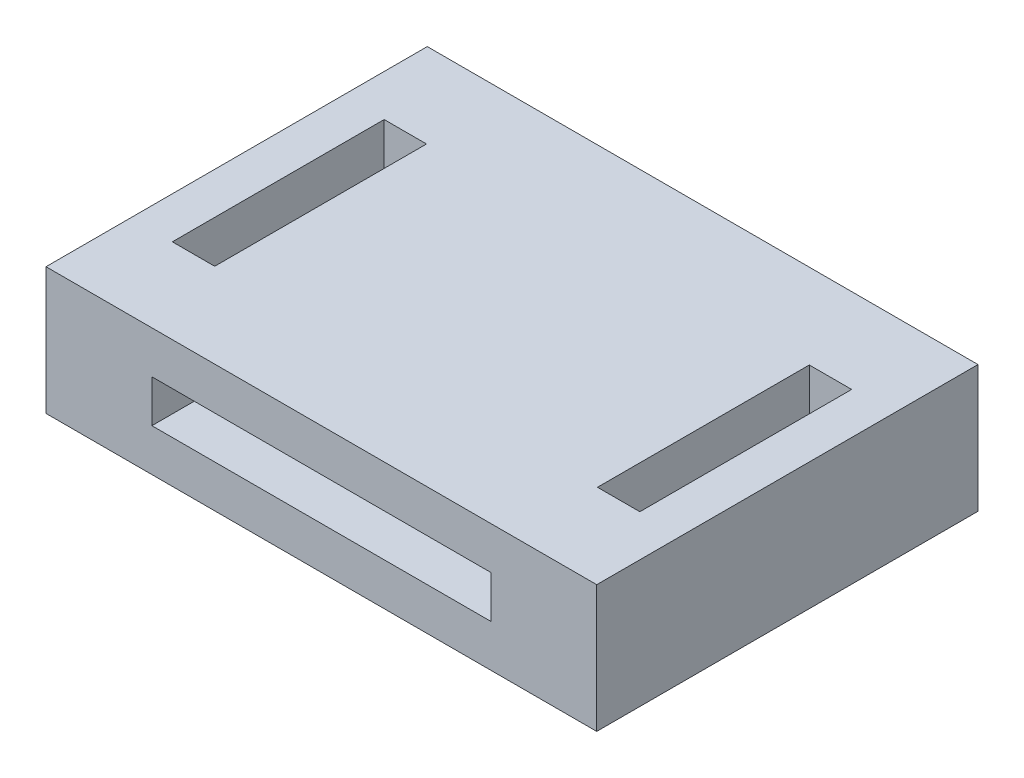
from build123d import *

# Parameters (mm, degrees)
SKETCH1_W           = 33.02
SKETCH1_H           = 22.86
SKETCH1_W_2         = 2.54
SKETCH1_H_2         = 12.7
BOSS_EXTRUDE2_DEPTH = 2.54
SKETCH3_R           = 1.016
BOSS_EXTRUDE3_DEPTH = 2.54
SKETCH4_W           = 33.02
SKETCH4_H           = 22.86
SKETCH4_W_2         = 2.54
SKETCH4_H_2         = 12.7
BOSS_EXTRUDE6_DEPTH = 2.54
SKETCH5_W           = 2.54
SKETCH5_H           = 12.7
BOSS_EXTRUDE7_DEPTH = 2.54


with BuildPart() as part:
    # Sketch1 → Boss-Extrude2 (new body)
    with BuildSketch(Plane(origin=(0, 0, 0), x_dir=(1, 0, 0), z_dir=(0, 1, 0))):
        Rectangle(SKETCH1_W, SKETCH1_H)
        with Locations((-12.74489899, 0)):
            Rectangle(SKETCH1_W_2, SKETCH1_H_2, mode=Mode.SUBTRACT)
        with Locations((12.74489899, 0)):
            Rectangle(SKETCH1_W_2, SKETCH1_H_2, mode=Mode.SUBTRACT)
    extrude(amount=BOSS_EXTRUDE2_DEPTH)

    # Sketch3 → Boss-Extrude3 (add)
    with BuildSketch(Plane(origin=(0, 2.54, 0), x_dir=(1, 0, 0), z_dir=(0, 1, 0))):
        with Locations(Location((-5.318941048, 1.27, 0), (0, 0, 90))):
            Circle(SKETCH3_R)
        with Locations(Location((5.318941048, 1.27, 0), (0, 0, 90))):
            Circle(SKETCH3_R)
    extrude(amount=BOSS_EXTRUDE3_DEPTH)

    # Sketch4 → Boss-Extrude6 (add)
    with BuildSketch(Plane(origin=(0, 5.08, 0), x_dir=(1, 0, 0), z_dir=(0, 1, 0))):
        Rectangle(SKETCH4_W, SKETCH4_H)
        with Locations((-12.74489899, 0)):
            Rectangle(SKETCH4_W_2, SKETCH4_H_2, mode=Mode.SUBTRACT)
        with Locations((12.74489899, 0)):
            Rectangle(SKETCH4_W_2, SKETCH4_H_2, mode=Mode.SUBTRACT)
    extrude(amount=BOSS_EXTRUDE6_DEPTH)

    # Sketch5 → Boss-Extrude7 (add)
    with BuildSketch(Plane(origin=(0, 2.54, 0), x_dir=(1, 0, 0), z_dir=(0, 1, 0))):
        Polygon((-16.51, -11.43), (-16.51, 11.43), (16.51, 11.43), (16.51, -11.43), (10.16, -11.43), (10.16, 6.35), (-10.16, 6.35), (-10.16, -11.43), align=None)
        with Locations((-12.74489899, 0)):
            Rectangle(SKETCH5_W, SKETCH5_H, mode=Mode.SUBTRACT)
        with Locations((12.74489899, 0)):
            Rectangle(SKETCH5_W, SKETCH5_H, mode=Mode.SUBTRACT)
    extrude(amount=BOSS_EXTRUDE7_DEPTH)


solid = part.part
